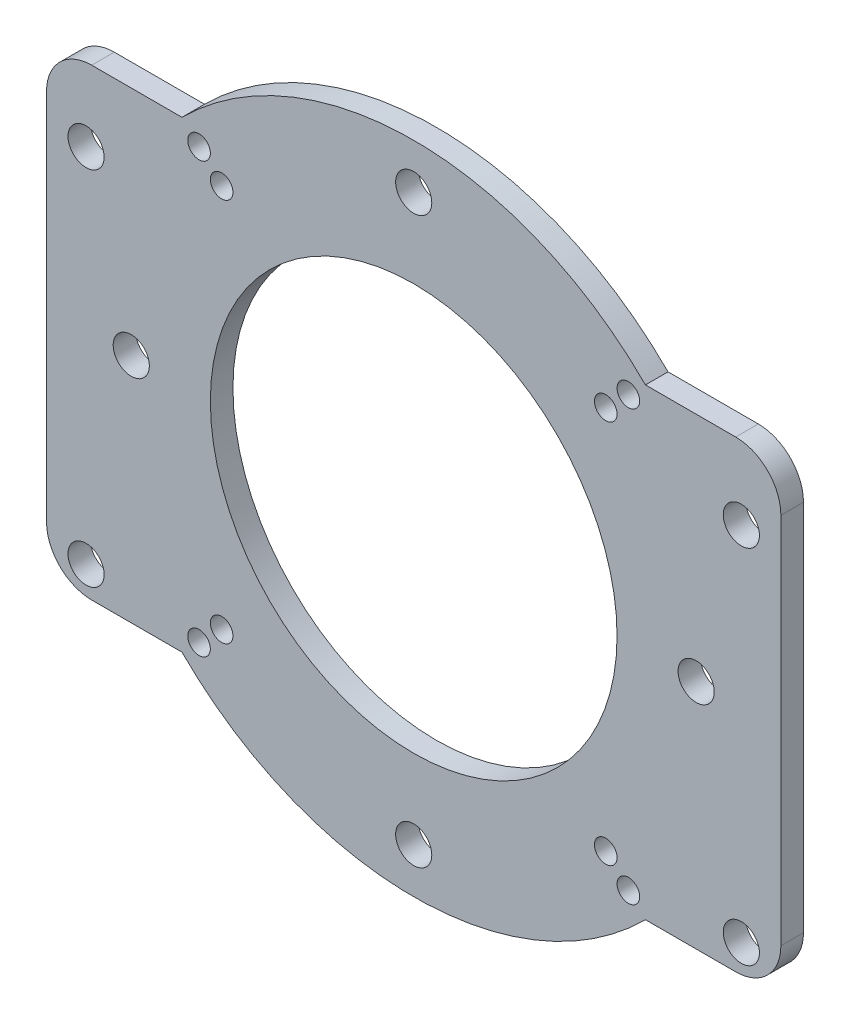
from build123d import *

# Parameters (mm, degrees)
SKETCH1_R             = 18
BOSS_EXTRUDE1_DEPTH   = 2
SKETCH2_R             = 1.6
CUT_EXTRUDE1_DEPTH    = 2
F_2_0MM_DOWEL_HOLE1_D = 2
SKETCH5_R             = 1.6
CUT_EXTRUDE4_DEPTH    = 44.603325561
FILLET1_R             = 4


with BuildPart() as part:
    # Sketch1 → Boss-Extrude1 (new body)
    with BuildSketch(Plane.XY):
        with BuildLine():
            Line((-32.5, 20.5), (-20.512191497, 20.5))
            ThreePointArc((-20.512191497, 20.5), (0, 29), (20.512191497, 20.5))
            Line((20.512191497, 20.5), (32.5, 20.5))
            Line((32.5, 20.5), (32.5, -20.5))
            Line((32.5, -20.5), (20.512191497, -20.5))
            ThreePointArc((20.512191497, -20.5), (0, -29), (-20.512191497, -20.5))
            Line((-20.512191497, -20.5), (-32.5, -20.5))
            Line((-32.5, -20.5), (-32.5, 20.5))
        make_face()
        Circle(SKETCH1_R, mode=Mode.SUBTRACT)
    extrude(amount=BOSS_EXTRUDE1_DEPTH)

    # Sketch2 → Cut-Extrude1 (cut)
    with BuildSketch(Plane.XY.offset(2)):
        with Locations((-29, 14)):
            Circle(SKETCH2_R)
        with Locations((-29, -18)):
            Circle(SKETCH2_R)
        with Locations((29, -18)):
            Circle(SKETCH2_R)
        with Locations((29, 14)):
            Circle(SKETCH2_R)
    extrude(amount=-CUT_EXTRUDE1_DEPTH, mode=Mode.SUBTRACT)

    # Ø2.0mm Dowel Hole1 (through all)
    with Locations(Plane(origin=(-19, 19, 2), x_dir=(1, 0, 0), z_dir=(0, 0, 1))):
        with Locations((0, 0), (2, -2), (36, -2), (38, 0), (36, -36), (38, -38), (0, -38), (2, -36)):
            Hole(F_2_0MM_DOWEL_HOLE1_D / 2)

    # Sketch5 → Cut-Extrude4 (cut, through all)
    with BuildSketch(Plane.XY):
        with Locations((0, 25)):
            Circle(SKETCH5_R)
        with Locations((-25, 0)):
            Circle(SKETCH5_R)
        with Locations((25, 0)):
            Circle(SKETCH5_R)
        with Locations((0, -25)):
            Circle(SKETCH5_R)
    extrude(amount=CUT_EXTRUDE4_DEPTH, mode=Mode.SUBTRACT)

    # Fillet1
    fillet1_edges = [part.edges().sort_by_distance(p)[0] for p in [
        (-32.5, -20.5, 1),
        (-32.5, 20.5, 1),
        (32.5, 20.5, 1),
        (32.5, -20.5, 1),
    ]]
    fillet(fillet1_edges, radius=FILLET1_R)


solid = part.part
